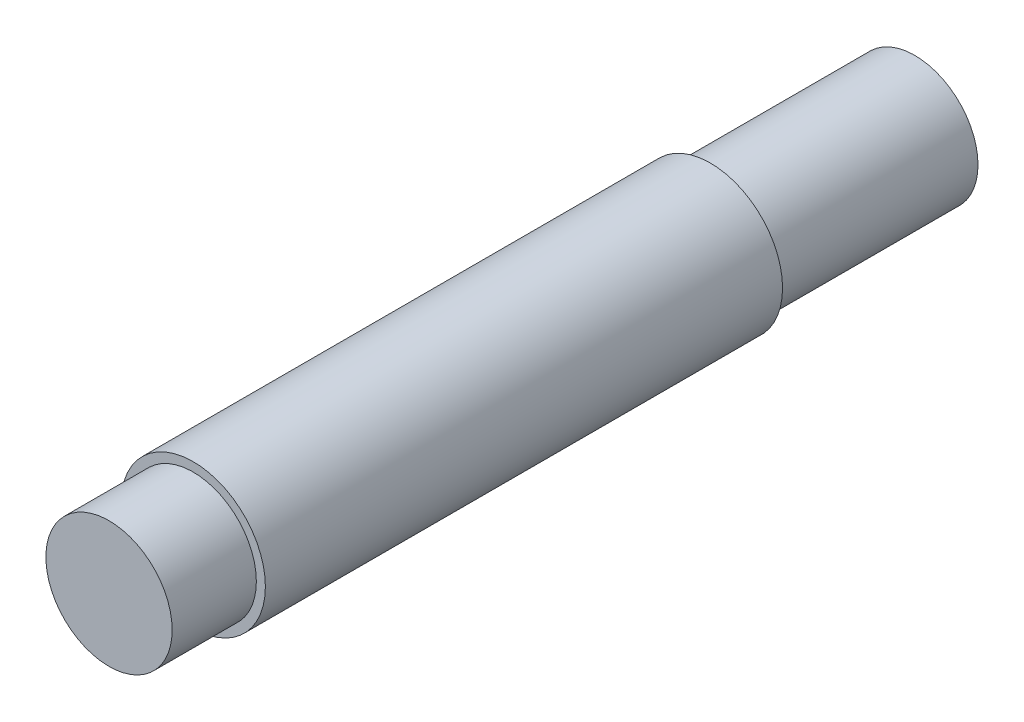
from build123d import *


with BuildPart() as part:
    # Sketch1 → Revolve1 (revolve)
    with BuildSketch(Plane(origin=(0, 0, 0), x_dir=(0, 0, -1), z_dir=(1, 0, 0)), mode=Mode.PRIVATE) as revolve1_sk:
        Polygon((-7, 0), (60, 0), (60, 5.25), (43, 5.25), (43, 6), (0, 6), (0, 5.25), (-7, 5.25), align=None)
    revolve(revolve1_sk.sketch.rotate(Axis((0, 0, 7), (0, 0, -1)), 90), axis=Axis((0, 0, 7), (0, 0, -1)))


solid = part.part
